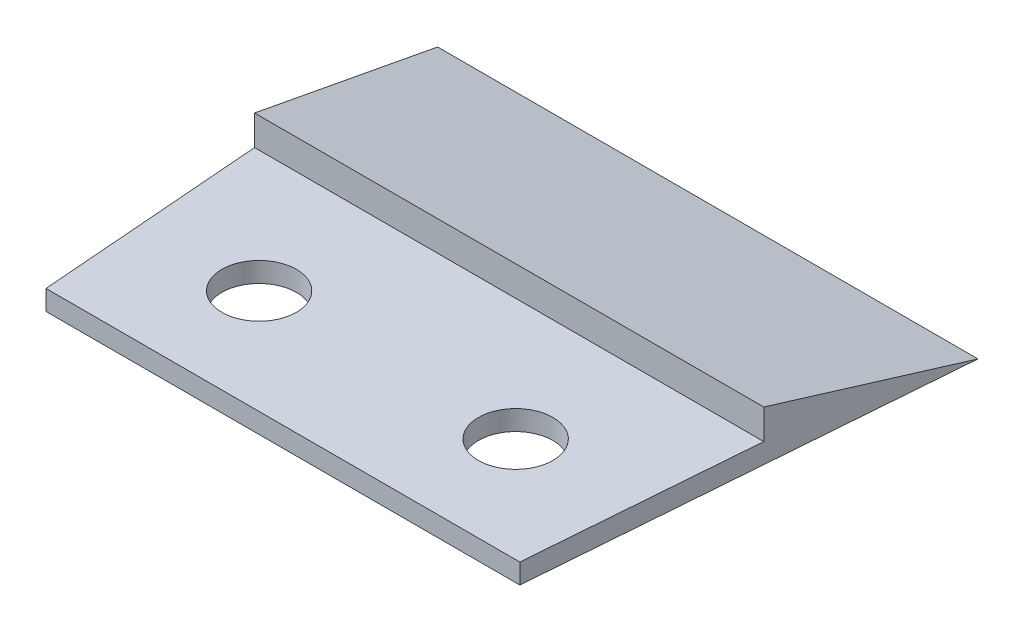
from build123d import *

# Parameters (mm, degrees)
SKETCH1_R                       = 2.8448
BOSS_EXTRUDE1_DEPTH             = 1.524
BOSS_EXTRUDE2_REACH             = 31.04
BOSS_EXTRUDE2_DIRECTION_2_REACH = 31.04
CUT_EXTRUDE1_REACH              = 31.249
CUT_EXTRUDE1_DIRECTION_2_REACH  = 31.249


with BuildPart() as part:
    # Sketch1 → Boss-Extrude1 (new body)
    with BuildSketch(Plane(origin=(0, 0, 0), x_dir=(1, 0, 0), z_dir=(0, 1, 0))):
        Polygon((-20.228169231, 12.048978462), (-17.688169231, -20.386821538), (18.481430769, -20.386821538), (21.021430769, 12.048978462), align=None)
        with Locations((-9.395069231, -12.411221538)):
            Circle(SKETCH1_R, mode=Mode.SUBTRACT)
        with Locations((10.188330769, -12.411221538)):
            Circle(SKETCH1_R, mode=Mode.SUBTRACT)
    extrude(amount=BOSS_EXTRUDE1_DEPTH)

    # Boss-Extrude2: up to this plane
    boss_extrude2_end = Plane(origin=(19.95552113, 1.524, 1.562687637), z_dir=(-0.9969479165233839, 0, -0.07806953144270824))
    # Sketch4 → Boss-Extrude2 (add, up to the surface)
    with BuildSketch(Plane(origin=(0.396630769, 0, 0), x_dir=(0, 0, -1), z_dir=(1, 0, 0)), mode=Mode.PRIVATE) as boss_extrude2_sk1:
        Polygon((-3.114821538, 3.81), (-3.114821538, 1.524), (5.983458462, 1.524), align=None)
    boss_extrude2_tool1 = split(extrude(boss_extrude2_sk1.sketch, amount=BOSS_EXTRUDE2_REACH, mode=Mode.PRIVATE), bisect_by=boss_extrude2_end, keep=Keep.BOTH, mode=Mode.PRIVATE)
    add(boss_extrude2_tool1.solids().sort_by_distance((0.396631, 2.286, 0.082062))[0])

    # Boss-Extrude2 direction 2: up to this plane
    boss_extrude2_direction_2_end = Plane(origin=(-19.167094403, 1.524, 1.500947095), z_dir=(-0.9969479165233839, 0, 0.07806953144270846))
    # Sketch4 → Boss-Extrude2 direction 2 (add, up to the surface)
    with BuildSketch(Plane(origin=(0.396630769, 0, 0), x_dir=(0, 0, -1), z_dir=(1, 0, 0)), mode=Mode.PRIVATE) as boss_extrude2_direction_2_sk1:
        Polygon((-3.114821538, 3.81), (-3.114821538, 1.524), (5.983458462, 1.524), align=None)
    boss_extrude2_direction_2_tool1 = split(extrude(boss_extrude2_direction_2_sk1.sketch, amount=-BOSS_EXTRUDE2_DIRECTION_2_REACH, mode=Mode.PRIVATE), bisect_by=boss_extrude2_direction_2_end, keep=Keep.BOTH, mode=Mode.PRIVATE)
    add(boss_extrude2_direction_2_tool1.solids().sort_by_distance((0.396631, 2.286, 0.082062))[0])

    # Cut-Extrude1: up to this plane
    cut_extrude1_end = Plane(origin=(-19.167094403, 1.524, 1.500947095), z_dir=(-0.9969479165233839, 0, 0.07806953144270846))
    # Sketch4<3> → Cut-Extrude1 (cut, up to the surface)
    with BuildSketch(Plane(origin=(0.396630769, 0, 0), x_dir=(0, 0, -1), z_dir=(1, 0, 0)), mode=Mode.PRIVATE) as cut_extrude1_sk1:
        Polygon((12.048978462, 1.524), (5.983458462, 1.524), (12.048978462, 0), align=None)
    cut_extrude1_tool1 = split(extrude(cut_extrude1_sk1.sketch, amount=-CUT_EXTRUDE1_REACH, mode=Mode.PRIVATE), bisect_by=cut_extrude1_end, keep=Keep.BOTH, mode=Mode.PRIVATE)
    add(cut_extrude1_tool1.solids().sort_by_distance((0.396631, 1.016, -10.027138))[0], mode=Mode.SUBTRACT)

    # Cut-Extrude1 direction 2: up to this plane
    cut_extrude1_direction_2_end = Plane(origin=(19.95552113, 1.524, 1.562687637), z_dir=(-0.9969479165233839, 0, -0.07806953144270824))
    # Sketch4<3> → Cut-Extrude1 direction 2 (cut, up to the surface)
    with BuildSketch(Plane(origin=(0.396630769, 0, 0), x_dir=(0, 0, -1), z_dir=(1, 0, 0)), mode=Mode.PRIVATE) as cut_extrude1_direction_2_sk1:
        Polygon((12.048978462, 1.524), (5.983458462, 1.524), (12.048978462, 0), align=None)
    cut_extrude1_direction_2_tool1 = split(extrude(cut_extrude1_direction_2_sk1.sketch, amount=CUT_EXTRUDE1_DIRECTION_2_REACH, mode=Mode.PRIVATE), bisect_by=cut_extrude1_direction_2_end, keep=Keep.BOTH, mode=Mode.PRIVATE)
    add(cut_extrude1_direction_2_tool1.solids().sort_by_distance((0.396631, 1.016, -10.027138))[0], mode=Mode.SUBTRACT)


solid = part.part
